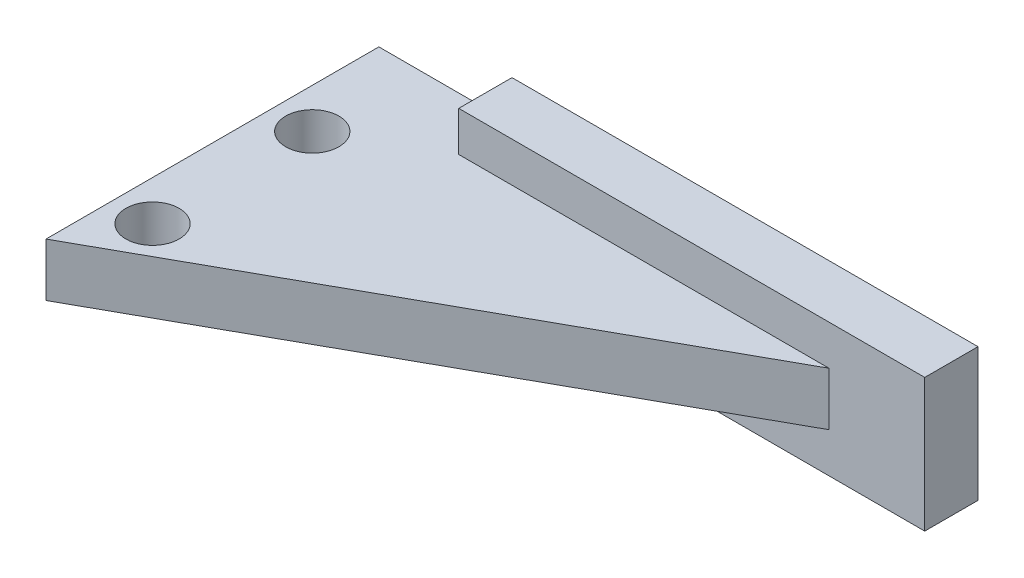
from build123d import *

# Parameters (mm, degrees)
BOSS_EXTRU_1_DEPTH      = 4
ESQUISSE2_R             = 2
ENL_V_MAT_EXTRU_1_DEPTH = 4
ESQUISSE4_W             = 35
ESQUISSE4_H             = 10
BOSS_EXTRU_2_DEPTH      = 4


with BuildPart() as part:
    # Esquisse1 → Boss.-Extru.1 (new body)
    with BuildSketch(Plane(origin=(0, 0, 0), x_dir=(1, 0, 0), z_dir=(0, 1, 0))):
        Polygon((0, 0), (45, 25), (0, 25), align=None)
    extrude(amount=BOSS_EXTRU_1_DEPTH)

    # Esquisse2 → Enlèv. mat.-Extru.1 (cut)
    with BuildSketch(Plane(origin=(0, 4, 0), x_dir=(1, 0, 0), z_dir=(0, 1, 0))):
        with Locations(Location((3, 17, 0), (0, 0, 270))):
            Circle(ESQUISSE2_R)
        with Locations(Location((3, 5, 0), (0, 0, 270))):
            Circle(ESQUISSE2_R)
    extrude(amount=-ENL_V_MAT_EXTRU_1_DEPTH, mode=Mode.SUBTRACT)

    # Esquisse4 → Boss.-Extru.2 (add)
    with BuildSketch(Plane(origin=(0, 0, -25), x_dir=(-1, 0, 0), z_dir=(0, 0, -1))):
        with Locations((-27.5, 2)):
            Rectangle(ESQUISSE4_W, ESQUISSE4_H)
    extrude(amount=-BOSS_EXTRU_2_DEPTH)


solid = part.part
